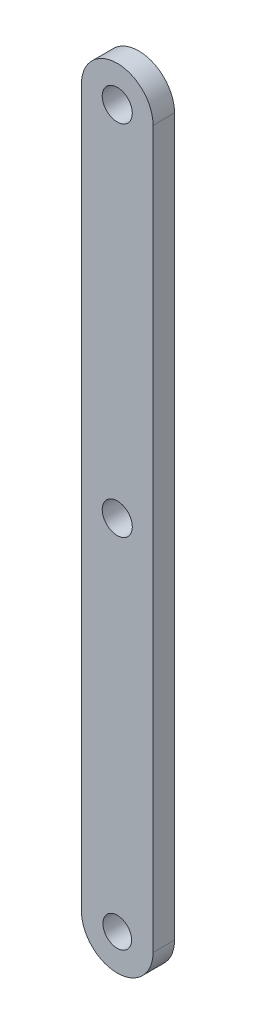
from build123d import *

# Parameters (mm, degrees)
SKETCH_1_R      = 1
SKETCH_1_R_2    = 1.05
EXTRUDE_1_DEPTH = 1.5


with BuildPart() as part:
    # 草图1 → 凸台-拉伸1 (new body)
    with BuildSketch(Plane.XY):
        with BuildLine():
            Line((-2.5, 0), (-2.5, 50))
            ThreePointArc((-2.5, 50), (0, 52.5), (2.5, 50))
            Line((2.5, 50), (2.5, 0))
            ThreePointArc((2.5, 0), (0, -2.5), (-2.5, 0))
        make_face()
        Circle(SKETCH_1_R, mode=Mode.SUBTRACT)
        with Locations((0, 50)):
            Circle(SKETCH_1_R_2, mode=Mode.SUBTRACT)
        with Locations((0, 25)):
            Circle(SKETCH_1_R_2, mode=Mode.SUBTRACT)
    extrude(amount=EXTRUDE_1_DEPTH)


solid = part.part
